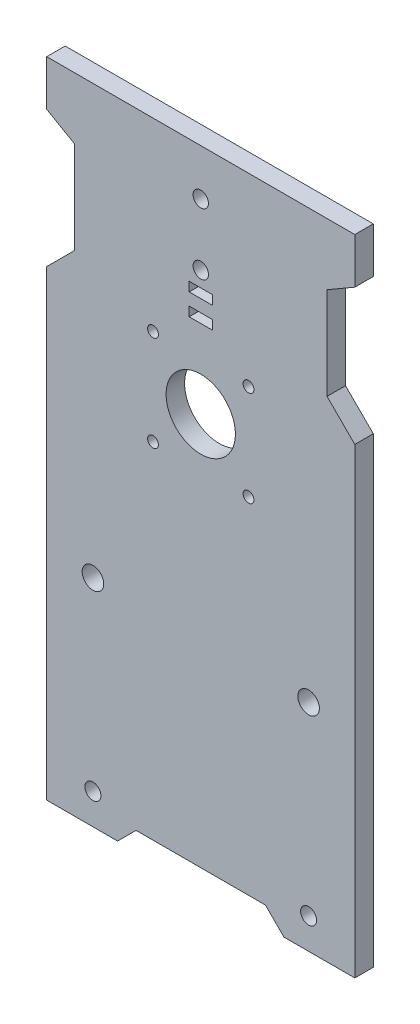
from build123d import *

# Parameters (mm, degrees)
CROQUIS1_R              = 2.6
CROQUIS1_R_2            = 3.5
CROQUIS1_R_3            = 1.75
CROQUIS1_R_4            = 11.25
CROQUIS1_R_5            = 2.5
CROQUIS1_W              = 7.5
CROQUIS1_H              = 3
SALIENTE_EXTRUIR1_DEPTH = 6


with BuildPart() as part:
    # Croquis1 → Saliente-Extruir1 (new body)
    with BuildSketch(Plane.XY):
        Polygon((-50, -104.5), (-50, 45.5), (-41, 54.5), (-41, 84.5), (-50, 89.696152423), (-50, 104.5), (50, 104.5), (50, 89.696152423), (41, 84.5), (41, 54.5), (50, 45.5), (50, -104.5), (27, -104.5), (21, -98.5), (-21, -98.5), (-27, -104.5), align=None)
        with Locations((-35, -94.5)):
            Circle(CROQUIS1_R, mode=Mode.SUBTRACT)
        with Locations((-35, -34.5)):
            Circle(CROQUIS1_R_2, mode=Mode.SUBTRACT)
        with Locations((35, -34.5)):
            Circle(CROQUIS1_R_2, mode=Mode.SUBTRACT)
        with Locations((35, -94.5)):
            Circle(CROQUIS1_R, mode=Mode.SUBTRACT)
        with Locations((-15.5, 13.5)):
            Circle(CROQUIS1_R_3, mode=Mode.SUBTRACT)
        with Locations((15.5, 13.5)):
            Circle(CROQUIS1_R_3, mode=Mode.SUBTRACT)
        with Locations((0, 29)):
            Circle(CROQUIS1_R_4, mode=Mode.SUBTRACT)
        with Locations((15.5, 44.5)):
            Circle(CROQUIS1_R_3, mode=Mode.SUBTRACT)
        with Locations((-15.5, 44.5)):
            Circle(CROQUIS1_R_3, mode=Mode.SUBTRACT)
        with Locations((0, 69.5)):
            Circle(CROQUIS1_R_5, mode=Mode.SUBTRACT)
        with Locations((0, 89.5)):
            Circle(CROQUIS1_R_5, mode=Mode.SUBTRACT)
        with Locations((0, 56)):
            Rectangle(CROQUIS1_W, CROQUIS1_H, mode=Mode.SUBTRACT)
        with Locations((0, 63)):
            Rectangle(CROQUIS1_W, CROQUIS1_H, mode=Mode.SUBTRACT)
    extrude(amount=SALIENTE_EXTRUIR1_DEPTH)


solid = part.part
